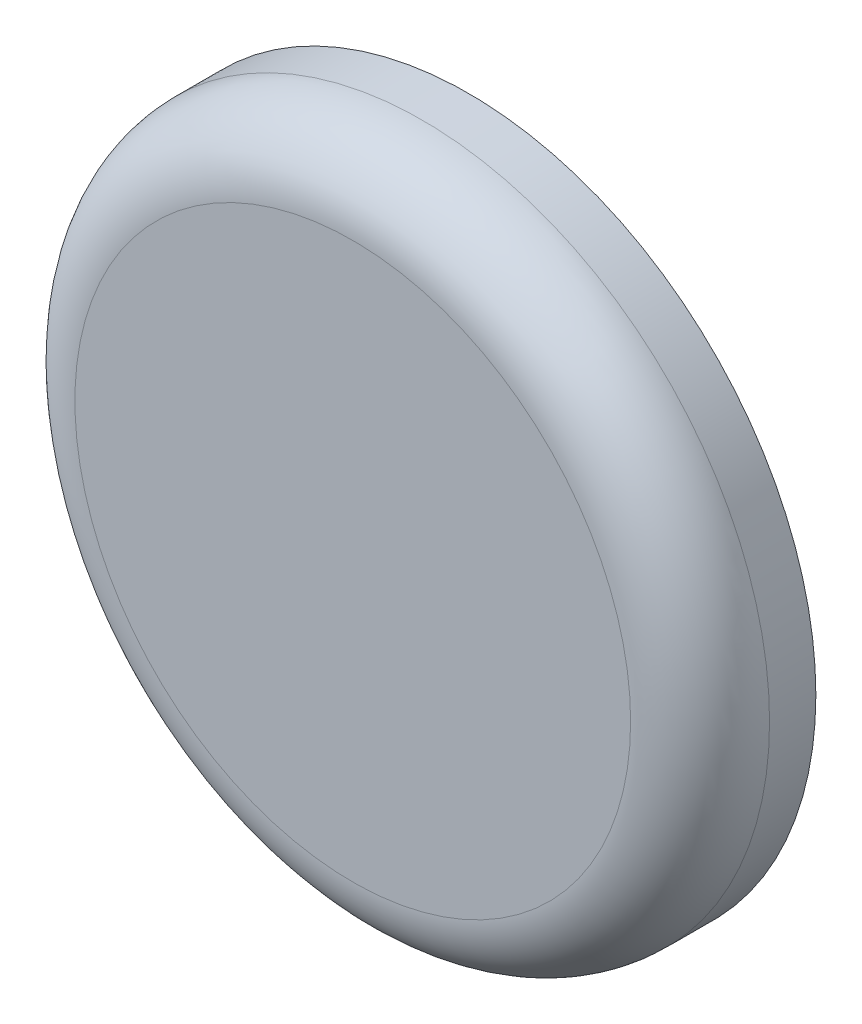
from build123d import *

# Parameters (mm, degrees)
SKETCH1_R           = 15
BOSS_EXTRUDE1_DEPTH = 5
FILLET1_R           = 3
SKETCH2_R           = 1.8
CUT_EXTRUDE1_DEPTH  = 2.2


with BuildPart() as part:
    # Sketch1 → Boss-Extrude1 (new body)
    with BuildSketch(Plane.XY):
        Circle(SKETCH1_R)
    extrude(amount=BOSS_EXTRUDE1_DEPTH)

    # Fillet1
    fillet1_edges = [part.edges().sort_by_distance(p)[0] for p in [
        (-15, 0, 5),
    ]]
    fillet(fillet1_edges, radius=FILLET1_R)

    # Sketch2 → Cut-Extrude1 (cut)
    with BuildSketch(Plane(origin=(0, 0, 0), x_dir=(-1, 0, 0), z_dir=(0, 0, -1))):
        Circle(SKETCH2_R)
    extrude(amount=-CUT_EXTRUDE1_DEPTH, mode=Mode.SUBTRACT)


solid = part.part
